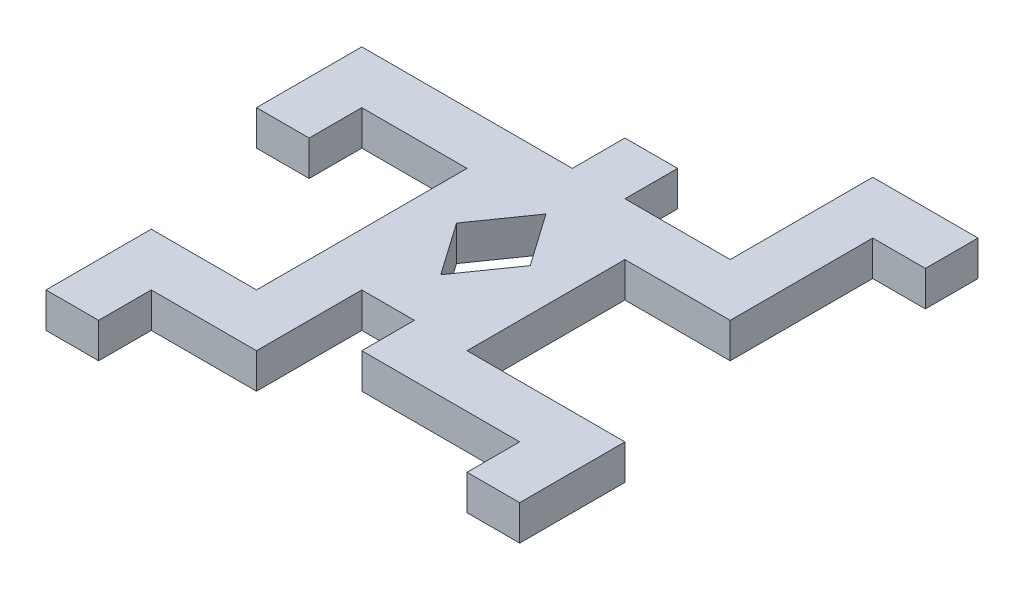
from build123d import *

# Parameters (mm, degrees)
SKETCH1_W           = 22.5
SKETCH1_H           = 30
SKETCH1_W_2         = 7.5
SKETCH1_H_2         = 7.5
BOSS_EXTRUDE1_DEPTH = 5
CUT_EXTRUDE1_DEPTH  = 51.698249477


with BuildPart() as part:
    # Sketch1 → Boss-Extrude1 (new body)
    with BuildSketch(Plane(origin=(0, 0, 0), x_dir=(1, 0, 0), z_dir=(0, 1, 0))):
        Polygon((-11.25, 7.5), (-11.25, 15), (-33.75, 15), (-33.75, 0), (-26.25, 0), (-26.25, 7.5), align=None)
        Rectangle(SKETCH1_W, SKETCH1_H)
        with Locations((0, 18.75)):
            Rectangle(SKETCH1_W_2, SKETCH1_H_2)
        Polygon((18.75, 15), (11.25, 15), (11.25, 7.5), (26.25, 7.5), (26.25, 27.813163598), (33.75, 27.813163598), (33.75, 35.313163598), (18.75, 35.313163598), align=None)
        Polygon((11.25, -15), (3.75, -15), (3.75, -22.5), (26.25, -22.5), (26.25, -30), (33.75, -30), (33.75, -15), align=None)
        Polygon((-3.75, -15), (-11.25, -15), (-11.25, -22.5), (-26.25, -22.5), (-26.25, -37.5), (-18.75, -37.5), (-18.75, -30), (-3.75, -30), align=None)
    extrude(amount=BOSS_EXTRUDE1_DEPTH)

    # Sketch2 → Cut-Extrude1 (cut, through all)
    with BuildSketch(Plane(origin=(0, 5, 0), x_dir=(1, 0, 0), z_dir=(0, 1, 0))):
        Polygon((0, 7.5), (-5.25, 0), (0, -7.5), (5.25, 0), align=None)
    extrude(amount=-CUT_EXTRUDE1_DEPTH, mode=Mode.SUBTRACT)


solid = part.part
